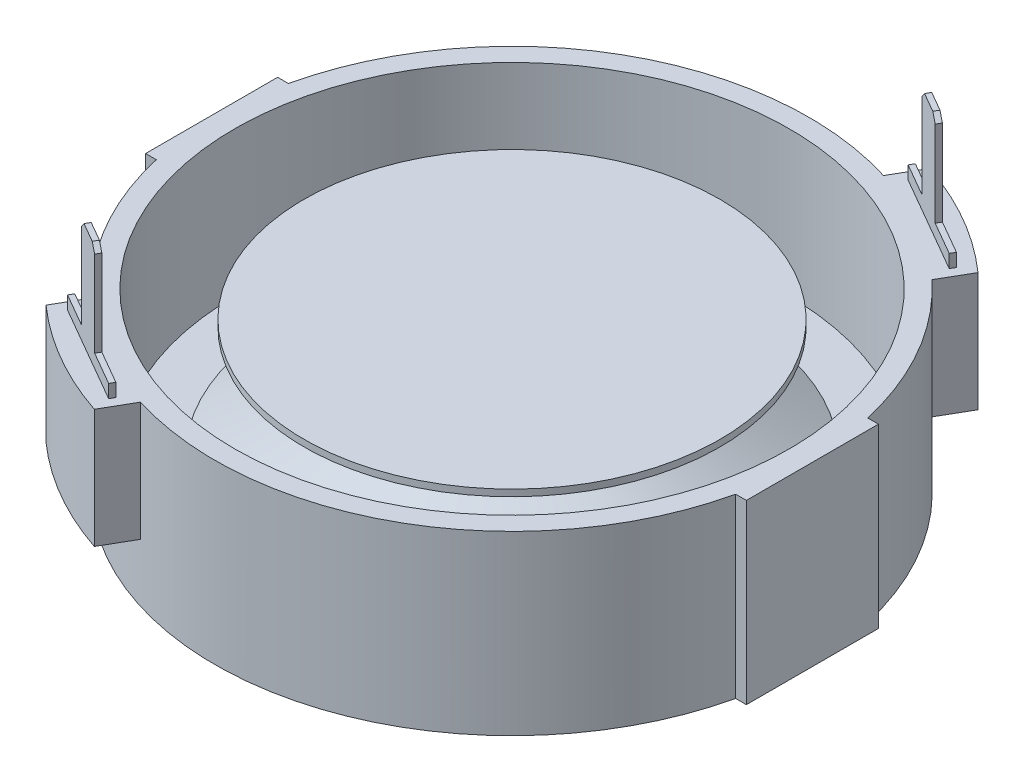
from build123d import *

# Parameters (mm, degrees)
SKETCH_1_R          = 22.5
EXTRUDE_1_DEPTH     = 13.4
SKETCH_5_R          = 21.001588026
CUT_EXTRUDE_1_DEPTH = 11
SKETCH_6_R          = 8
CUT_EXTRUDE_2_DEPTH = 3
EXTRUDE_START       = -9
EXTRUDE_6_DEPTH     = 9
EXTRUDE_7_DEPTH     = 1
EXTRUDE_8_DEPTH     = 7
CHAMFER_1_SIZE      = 0.5
SKETCH_13_R         = 9.5
CUT_EXTRUDE_4_DEPTH = 2
EXTRUDE_10_DEPTH    = 13.4


with BuildPart() as part:
    # Эскиз1 → Бобышка-Вытянуть1 (new body)
    with BuildSketch(Plane(origin=(0, 0, 0), x_dir=(1, 0, 0), z_dir=(0, 1, 0))):
        with Locations(Location((0, 0, 0), (0, 0, 270))):
            Circle(SKETCH_1_R)
    extrude(amount=EXTRUDE_1_DEPTH)

    # Эскиз5 → Вырез-Вытянуть1 (cut)
    with BuildSketch(Plane(origin=(0, 13.4, 0), x_dir=(1, 0, 0), z_dir=(0, 1, 0))):
        with Locations(Location((0, 0, 0), (0, 0, 270))):
            Circle(SKETCH_5_R)
    extrude(amount=-CUT_EXTRUDE_1_DEPTH, mode=Mode.SUBTRACT)

    # Эскиз6 → Вырез-Вытянуть2 (cut)
    with BuildSketch(Plane(origin=(0, 0, 0), x_dir=(-1, 0, 0), z_dir=(0, -1, 0))):
        with Locations(Location((0, 0, 0), (0, 0, 90))):
            Circle(SKETCH_6_R)
    extrude(amount=-CUT_EXTRUDE_2_DEPTH, mode=Mode.SUBTRACT)

    # Эскиз8 → Бобышка-Вытянуть6 (add)
    with BuildSketch(Plane(origin=(0, 13.4, 0), x_dir=(1, 0, 0), z_dir=(0, 1, 0)).offset(EXTRUDE_START)):
        with BuildLine():
            Line((7.917321695, 23.713203436), (6.638578465, 21.498355192))
            ThreePointArc((6.638578465, 21.498355192), (11.25, 19.485571585), (15.298832503, 16.498355192))
            Line((15.298832503, 16.498355192), (16.577575733, 18.713203436))
            ThreePointArc((16.577575733, 18.713203436), (12.5, 21.650635095), (7.917321695, 23.713203436))
        make_face()
        with BuildLine():
            Line((-7.917321695, -23.713203436), (-6.638578465, -21.498355192))
            ThreePointArc((-6.638578465, -21.498355192), (-11.25, -19.485571585), (-15.298832503, -16.498355192))
            Line((-15.298832503, -16.498355192), (-16.577575733, -18.713203436))
            ThreePointArc((-16.577575733, -18.713203436), (-12.5, -21.650635095), (-7.917321695, -23.713203436))
        make_face()
    extrude(amount=EXTRUDE_6_DEPTH)

    # Эскиз9 → Бобышка-Вытянуть7 (add)
    with BuildSketch(Plane(origin=(0, 13.4, 0), x_dir=(1, 0, 0), z_dir=(0, 1, 0))):
        Polygon((8.069392034, 22.476596989), (7.869392034, 22.130186827), (15.230607966, 17.880186827), (15.430607966, 18.226596989), align=None)
        Polygon((-8.069392034, -22.476596989), (-15.430607966, -18.226596989), (-15.230607966, -17.880186827), (-7.869392034, -22.130186827), align=None)
    extrude(amount=EXTRUDE_7_DEPTH)

    # Эскиз10 → Бобышка-Вытянуть8 (add)
    with BuildSketch(Plane(origin=(0, 14.4, 0), x_dir=(1, 0, 0), z_dir=(0, 1, 0))):
        Polygon((10.580865705, 21.026596989), (10.380865705, 20.680186827), (12.719134295, 19.330186827), (12.919134295, 19.676596989), align=None)
        Polygon((-10.580865705, -21.026596989), (-12.919134295, -19.676596989), (-12.719134295, -19.330186827), (-10.380865705, -20.680186827), align=None)
    extrude(amount=EXTRUDE_8_DEPTH)

    # Фаска1
    chamfer_1_edges = [part.edges().sort_by_distance(p)[0] for p in [
        (10.480865705, 21.4, -20.853391908),
        (12.819134295, 21.4, -19.503391908),
        (-10.480865705, 21.4, 20.853391908),
        (-12.819134295, 21.4, 19.503391908),
    ]]
    chamfer(chamfer_1_edges, length=CHAMFER_1_SIZE)

    # Эскиз11 → Повернуть1 (revolve)
    with BuildSketch(Plane(origin=(0, 0, 0), x_dir=(0, 0, -1), z_dir=(1, 0, 0))):
        Polygon((20.5, 2.4), (17.5, 2.4), (5, 9.616878365), (5, 10.9), (15.75, 10.9), (15.75, 11.4), (0, 11.4), (0, 10.9), (4.5, 10.9), (4.5, 9.32820323), (17.366025404, 1.9), (20.5, 1.9), align=None)
    revolve(axis=Axis((0, 0, 0), (0, 1, 0)))

    # Эскиз13 → Вырез-Вытянуть4 (cut)
    with BuildSketch(Plane.XZ):
        with Locations(Location((0, 0, 0), (0, 0, 270))):
            Circle(SKETCH_13_R)
    extrude(amount=-CUT_EXTRUDE_4_DEPTH, mode=Mode.SUBTRACT)

    # Эскиз15 → Бобышка-Вытянуть10 (add)
    with BuildSketch(Plane.XZ):
        with BuildLine():
            Line((-21.937410968, 5), (-22.75, 5))
            Line((-22.75, 5), (-22.75, -5))
            Line((-22.75, -5), (-21.937410968, -5))
            ThreePointArc((-21.937410968, -5), (-22.5, 0), (-21.937410968, 5))
        make_face()
        with BuildLine():
            Line((22.75, 5), (22.75, -5))
            Line((22.75, -5), (21.937410968, -5))
            ThreePointArc((21.937410968, -5), (22.5, 0), (21.937410968, 5))
            Line((21.937410968, 5), (22.75, 5))
        make_face()
    extrude(amount=-EXTRUDE_10_DEPTH)


solid = part.part
